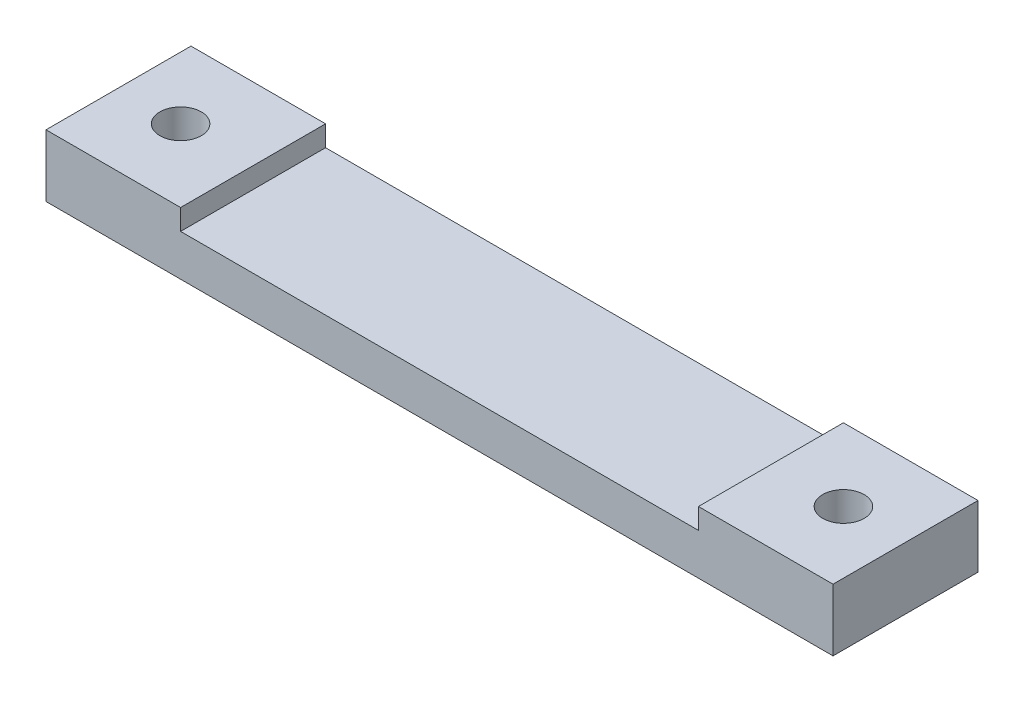
from build123d import *

# Parameters (mm, degrees)
SKETCH1_W           = 38
SKETCH1_H           = 7
BOSS_EXTRUDE1_DEPTH = 2
SKETCH2_W           = 6.498713404
SKETCH2_H           = 7
SKETCH2_W_2         = 6.49777259
BOSS_EXTRUDE2_DEPTH = 1
SKETCH3_R           = 1
CUT_EXTRUDE1_DEPTH  = 3


with BuildPart() as part:
    # Sketch1 → Boss-Extrude1 (new body)
    with BuildSketch(Plane(origin=(0, 0, 0), x_dir=(1, 0, 0), z_dir=(0, 1, 0))):
        Rectangle(SKETCH1_W, SKETCH1_H)
    extrude(amount=BOSS_EXTRUDE1_DEPTH)

    # Sketch2 → Boss-Extrude2 (add)
    with BuildSketch(Plane(origin=(0, 2, 0), x_dir=(1, 0, 0), z_dir=(0, 1, 0))):
        with Locations((-15.750643298, 0)):
            Rectangle(SKETCH2_W, SKETCH2_H)
        with Locations((15.751113705, 0)):
            Rectangle(SKETCH2_W_2, SKETCH2_H)
    extrude(amount=BOSS_EXTRUDE2_DEPTH)

    # Sketch3 → Cut-Extrude1 (cut)
    with BuildSketch(Plane(origin=(0, 3, 0), x_dir=(1, 0, 0), z_dir=(0, 1, 0))):
        with Locations(Location((-16.001286596, 0, 0), (0, 0, 270))):
            Circle(SKETCH3_R)
        with Locations(Location((16.00222741, 0, 0), (0, 0, 270))):
            Circle(SKETCH3_R)
    extrude(amount=-CUT_EXTRUDE1_DEPTH, mode=Mode.SUBTRACT)


solid = part.part
